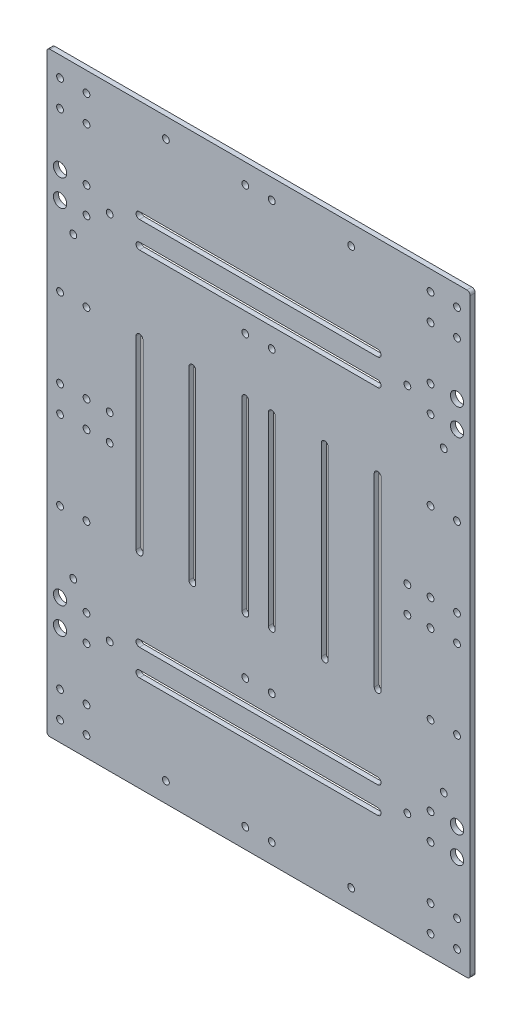
from build123d import *

# Parameters (mm, degrees)
SKETCH1_W                  = 256
SKETCH1_H                  = 360
BOSS_EXTRUDE1_DEPTH        = 3
FILLET1_R                  = 2
F_4_1_4_1_DIAMETER_HOLE1_D = 4.1
F_8_0_8_DIAMETER_HOLE1_D   = 8
CUT_EXTRUDE1_DEPTH         = 221.89137602
MIRROR2_COPY_1_D           = 4.1
MIRROR2_COPY_2_D           = 8
MIRROR2_COPY_3_DEPTH       = 221.89137602


with BuildPart() as part:
    # Sketch1 → Boss-Extrude1 (new body)
    with BuildSketch(Plane.XY):
        Rectangle(SKETCH1_W, SKETCH1_H)
    extrude(amount=BOSS_EXTRUDE1_DEPTH)

    # Fillet1
    fillet1_edges = [part.edges().sort_by_distance(p)[0] for p in [
        (128, -180, 1.5),
        (-128, -180, 1.5),
        (-128, 180, 1.5),
        (128, 180, 1.5),
    ]]
    fillet(fillet1_edges, radius=FILLET1_R)

    # Ø4.1 (4.1) Diameter Hole1 (through all)
    with Locations(Plane.XY.offset(3)):
        with Locations((90, 8), (120, 8), (104, 8), (104, 56), (120, 56), (104, 104), (112, 90.15), (104, 120), (90, 112), (104, 152), (120, 152), (120, 168), (104, 168), (8, 168), (56, 168), (8, 90.15)):
            f_4_1_4_1_diameter_hole1 = Hole(F_4_1_4_1_DIAMETER_HOLE1_D / 2)

    # Ø8.0 (8) Diameter Hole1 (through all)
    with Locations(Plane.XY.offset(3)):
        with Locations((120, 120), (120, 104)):
            f_8_0_8_diameter_hole1 = Hole(F_8_0_8_DIAMETER_HOLE1_D / 2)

    # Sketch9 → Cut-Extrude1 (cut, through all)
    with BuildSketch(Plane.XY.offset(3)):
        with BuildLine():
            Line((0, 106.05), (72, 106.05))
            ThreePointArc((72, 106.05), (74.05, 104), (72, 101.95))
            Line((72, 101.95), (0, 101.95))
            Line((0, 101.95), (0, 106.05))
        make_face()
        with BuildLine():
            Line((0, 122.05), (72, 122.05))
            ThreePointArc((72, 122.05), (74.05, 120), (72, 117.95))
            Line((72, 117.95), (0, 117.95))
            Line((0, 117.95), (0, 122.05))
        make_face()
        with BuildLine():
            Line((5.95, -56), (5.95, 56))
            ThreePointArc((5.95, 56), (8, 58.05), (10.05, 56))
            Line((10.05, 56), (10.05, -56))
            ThreePointArc((10.05, -56), (8, -58.05), (5.95, -56))
        make_face()
        with BuildLine():
            Line((37.95, -56), (37.95, 56))
            ThreePointArc((37.95, 56), (40, 58.05), (42.05, 56))
            Line((42.05, 56), (42.05, -56))
            ThreePointArc((42.05, -56), (40, -58.05), (37.95, -56))
        make_face()
        with BuildLine():
            Line((69.95, -56), (69.95, 56))
            ThreePointArc((69.95, 56), (72, 58.05), (74.05, 56))
            Line((74.05, 56), (74.05, -56))
            ThreePointArc((74.05, -56), (72, -58.05), (69.95, -56))
        make_face()
    cut_extrude1 = extrude(amount=-CUT_EXTRUDE1_DEPTH, mode=Mode.SUBTRACT)

    # Mirror1: Ø4.1 (4.1) Diameter Hole1, Ø8.0 (8) Diameter Hole1, Cut-Extrude1 across plane
    add(f_4_1_4_1_diameter_hole1.mirror(Plane.ZX), mode=Mode.SUBTRACT)
    add(f_8_0_8_diameter_hole1.mirror(Plane.ZX), mode=Mode.SUBTRACT)
    add(cut_extrude1.mirror(Plane.ZX), mode=Mode.SUBTRACT)

    # Mirror2: Ø4.1 (4.1) Diameter Hole1, Ø8.0 (8) Diameter Hole1, Cut-Extrude1 across plane
    add(f_4_1_4_1_diameter_hole1.mirror(Plane(origin=(0, 0, 0), x_dir=(0, 0, 1), z_dir=(1, 0, 0))), mode=Mode.SUBTRACT)
    add(f_8_0_8_diameter_hole1.mirror(Plane(origin=(0, 0, 0), x_dir=(0, 0, 1), z_dir=(1, 0, 0))), mode=Mode.SUBTRACT)
    add(cut_extrude1.mirror(Plane(origin=(0, 0, 0), x_dir=(0, 0, 1), z_dir=(1, 0, 0))), mode=Mode.SUBTRACT)

    # Mirror2 copy 1 (through all)
    with Locations(Plane(origin=(0, 0, 3), x_dir=(-1, 0, 0), z_dir=(0, 0, 1))):
        with Locations((90, 8), (120, 8), (104, 8), (104, 56), (120, 56), (104, 104), (112, 90.15), (104, 120), (90, 112), (104, 152), (120, 152), (120, 168), (104, 168), (8, 168), (56, 168), (8, 90.15)):
            Hole(MIRROR2_COPY_1_D / 2)

    # Mirror2 copy 2 (through all)
    with Locations(Plane(origin=(0, 0, 3), x_dir=(-1, 0, 0), z_dir=(0, 0, 1))):
        with Locations((120, 120), (120, 104)):
            Hole(MIRROR2_COPY_2_D / 2)

    # Mirror2 copy 3 sketch → Mirror2 copy 3 (cut, through all)
    with BuildSketch(Plane(origin=(0, 0, 3), x_dir=(-1, 0, 0), z_dir=(0, 0, 1))):
        with BuildLine():
            Line((0, 106.05), (72, 106.05))
            ThreePointArc((72, 106.05), (74.05, 104), (72, 101.95))
            Line((72, 101.95), (0, 101.95))
            Line((0, 101.95), (0, 106.05))
        make_face()
        with BuildLine():
            Line((0, 122.05), (72, 122.05))
            ThreePointArc((72, 122.05), (74.05, 120), (72, 117.95))
            Line((72, 117.95), (0, 117.95))
            Line((0, 117.95), (0, 122.05))
        make_face()
        with BuildLine():
            Line((5.95, -56), (5.95, 56))
            ThreePointArc((5.95, 56), (8, 58.05), (10.05, 56))
            Line((10.05, 56), (10.05, -56))
            ThreePointArc((10.05, -56), (8, -58.05), (5.95, -56))
        make_face()
        with BuildLine():
            Line((37.95, -56), (37.95, 56))
            ThreePointArc((37.95, 56), (40, 58.05), (42.05, 56))
            Line((42.05, 56), (42.05, -56))
            ThreePointArc((42.05, -56), (40, -58.05), (37.95, -56))
        make_face()
        with BuildLine():
            Line((69.95, -56), (69.95, 56))
            ThreePointArc((69.95, 56), (72, 58.05), (74.05, 56))
            Line((74.05, 56), (74.05, -56))
            ThreePointArc((74.05, -56), (72, -58.05), (69.95, -56))
        make_face()
    extrude(amount=-MIRROR2_COPY_3_DEPTH, mode=Mode.SUBTRACT)


solid = part.part
